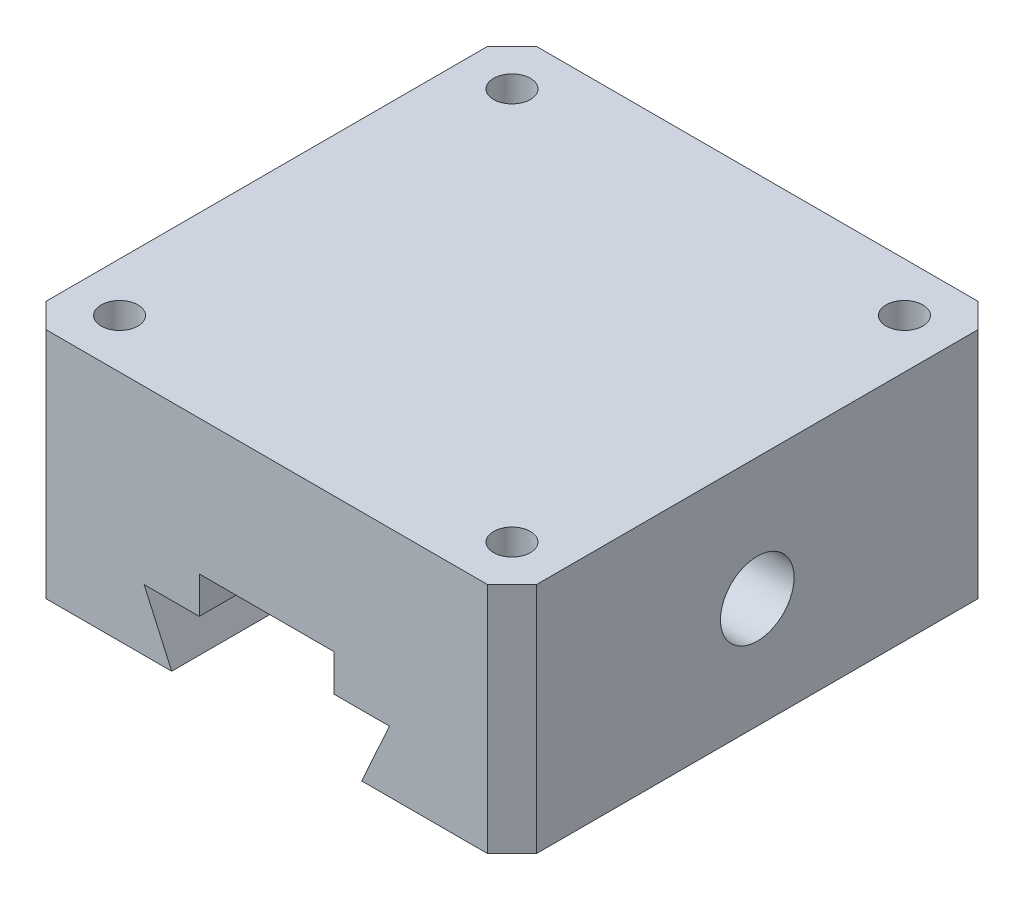
from build123d import *

# Parameters (mm, degrees)
EXTRUDE_1_DEPTH              = 20
CUT_EXTRUDE_1_REACH          = 50.59
SKETCH_8_W                   = 11
SKETCH_8_H                   = 6
HOLE_WIZARD_M6_3_D           = 5
HOLE_WIZARD_M6_3_DEPTH       = 35
HOLE_WIZARD_M6_3_CSINK_D     = 6.05
HOLE_WIZARD_M6_3_CSINK_ANGLE = 90
HOLE_WIZARD_M6_3_TIP         = 1.502151548
SKETCH_13_R                  = 3
CUT_EXTRUDE_2_DEPTH          = 45
CUT_EXTRUDE_3_DEPTH          = 7
CHAMFER_1_SIZE               = 2
SKETCH_15_R                  = 1.5
CUT_EXTRUDE_4_DEPTH          = 10


with BuildPart() as part:
    # 草图1 → 凸台-拉伸1 (new, symmetric)
    with BuildSketch(Plane.XY):
        Polygon((-10, 5), (10, 5), (7.75, 0), (20, 0), (20, 19), (-20, 19), (-20, 0), (-7.75, 0), align=None)
    extrude(amount=EXTRUDE_1_DEPTH, both=True)

    # 草图8 → 切除-拉伸1 (cut, up to next)
    with BuildSketch(Plane(origin=(0, 0, -20), x_dir=(-1, 0, 0), z_dir=(0, 0, -1)), mode=Mode.PRIVATE) as cut_extrude_1_sk1:
        with Locations((0, 5)):
            Rectangle(SKETCH_8_W, SKETCH_8_H)
    cut_extrude_1_tool1 = extrude(cut_extrude_1_sk1.sketch, amount=-CUT_EXTRUDE_1_REACH, mode=Mode.PRIVATE) & part.part
    add(cut_extrude_1_tool1.solids().sort_by_distance((0, 5, -20))[0], mode=Mode.SUBTRACT)

    # M6 螺纹孔3
    with Locations(Plane.ZY.offset(20)):
        with Locations((0, 6)):
            CounterSinkHole(HOLE_WIZARD_M6_3_D / 2, HOLE_WIZARD_M6_3_CSINK_D / 2, depth=HOLE_WIZARD_M6_3_DEPTH, counter_sink_angle=HOLE_WIZARD_M6_3_CSINK_ANGLE)
            with Locations((0, 0, -(HOLE_WIZARD_M6_3_DEPTH + HOLE_WIZARD_M6_3_TIP / 2))):  # 118° drill point
                Cone(0, HOLE_WIZARD_M6_3_D / 2, HOLE_WIZARD_M6_3_TIP, mode=Mode.SUBTRACT)

    # 草图13 → 切除-拉伸2 (cut)
    with BuildSketch(Plane(origin=(20, 0, 0), x_dir=(0, 0, -1), z_dir=(1, 0, 0))):
        with Locations((0, 9)):
            Circle(SKETCH_13_R)
    extrude(amount=-CUT_EXTRUDE_2_DEPTH, mode=Mode.SUBTRACT)

    # 草图14 → 切除-拉伸3 (cut)
    with BuildSketch(Plane.XZ.offset(-8)):
        with BuildLine():
            Line((5.5, 5.5), (5.5, -5.5))
            ThreePointArc((5.5, -5.5), (0, -11), (-5.5, -5.5))
            Line((-5.5, -5.5), (-5.5, 5.5))
            ThreePointArc((-5.5, 5.5), (0, 11), (5.5, 5.5))
        make_face()
    extrude(amount=-CUT_EXTRUDE_3_DEPTH, mode=Mode.SUBTRACT)

    # 倒角1
    chamfer_1_edges = [part.edges().sort_by_distance(p)[0] for p in [
        (20, 9.5, 20),
        (-20, 9.5, 20),
        (-20, 9.5, -20),
        (20, 9.5, -20),
    ]]
    chamfer(chamfer_1_edges, length=CHAMFER_1_SIZE)

    # 草图15 → 切除-拉伸4 (cut)
    with BuildSketch(Plane(origin=(0, 19, 0), x_dir=(1, 0, 0), z_dir=(0, 1, 0))):
        with Locations(Location((-16, 16, 0), (0, 0, 270))):
            Circle(SKETCH_15_R)
        with Locations(Location((16, 16, 0), (0, 0, 270))):
            Circle(SKETCH_15_R)
        with Locations(Location((16, -16, 0), (0, 0, 270))):
            Circle(SKETCH_15_R)
        with Locations(Location((-16, -16, 0), (0, 0, 270))):
            Circle(SKETCH_15_R)
    extrude(amount=-CUT_EXTRUDE_4_DEPTH, mode=Mode.SUBTRACT)


solid = part.part
